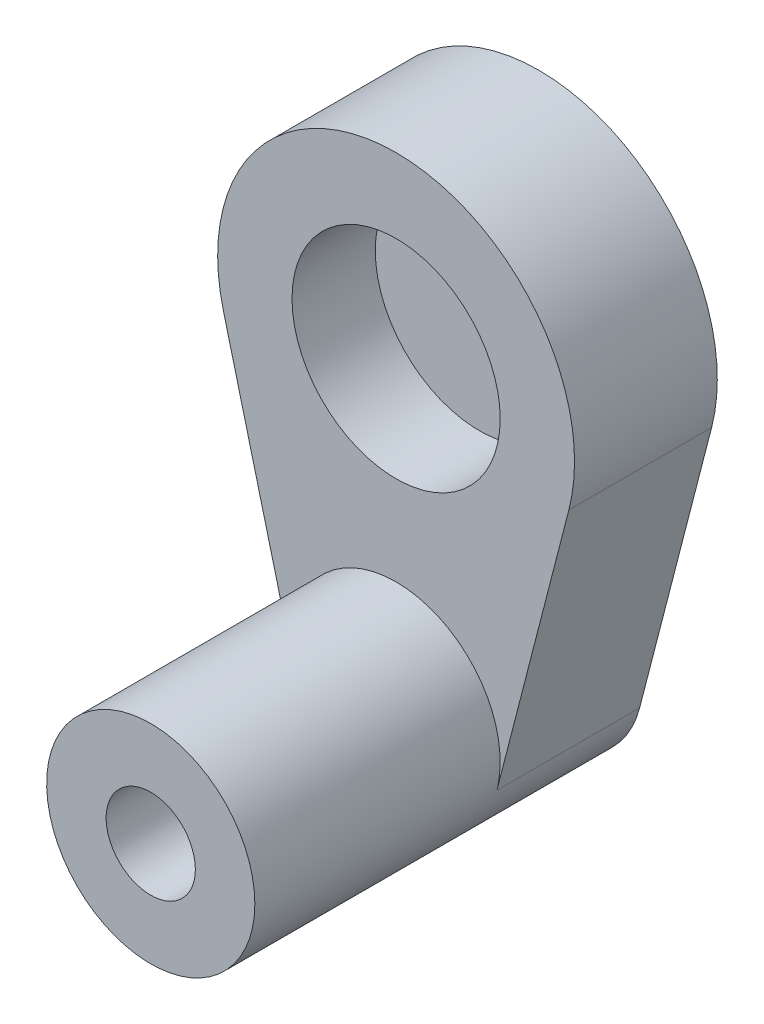
from build123d import *

# Parameters (mm, degrees)
SKETCH1_R           = 3.5
SKETCH1_R_2         = 1.5
BOSS_EXTRUDE1_DEPTH = 8.25
BOSS_EXTRUDE2_START = 2.8
SKETCH2_R           = 6
SKETCH2_R_2         = 3.5
SKETCH2_R_3         = 1.5
BOSS_EXTRUDE2_DEPTH = 2.8
BOSS_EXTRUDE3_START = 4.8
SKETCH2_3_R         = 6
SKETCH2_3_R_2       = 3.5
SKETCH2_3_R_3       = 1.5
BOSS_EXTRUDE3_DEPTH = 2


with BuildPart() as part:
    # Sketch1 → Boss-Extrude1 (new body)
    with BuildSketch(Plane.XY):
        Circle(SKETCH1_R)
        Circle(SKETCH1_R_2, mode=Mode.SUBTRACT)
    extrude(amount=BOSS_EXTRUDE1_DEPTH)

    # Sketch2 → Boss-Extrude2 (add)
    # profile 1 of 4: a face of its own
    with BuildSketch(Plane(origin=(0, 0, 0), x_dir=(-1, 0, 0), z_dir=(0, 0, -1)).offset(BOSS_EXTRUDE2_START)):
        with BuildLine():
            ThreePointArc((5.809475019, 8.5), (0, 4), (-5.809475019, 8.5))
            Line((-5.809475019, 8.5), (-3.388860428, -0.875))
            ThreePointArc((-3.388860428, -0.875), (-0.441015024, 3.472103937), (3.5, 0))
            ThreePointArc((3.5, 0), (3.472103937, -0.441015024), (3.388860428, -0.875))
            Line((3.388860428, -0.875), (5.809475019, 8.5))
        make_face()
    # profile 2 of 4: a face of its own
    with BuildSketch(Plane(origin=(0, 0, 0), x_dir=(-1, 0, 0), z_dir=(0, 0, -1)).offset(BOSS_EXTRUDE2_START)):
        with Locations((0, 10)):
            Circle(SKETCH2_R)
        with Locations((0, 10)):
            Circle(SKETCH2_R_2, mode=Mode.SUBTRACT)
    # profile 3 of 4: a face of its own
    with BuildSketch(Plane(origin=(0, 0, 0), x_dir=(-1, 0, 0), z_dir=(0, 0, -1)).offset(BOSS_EXTRUDE2_START)):
        with Locations(Location((0, 0, 0), (0, 0, 345.522487814))):
            Circle(SKETCH2_R_2)
        with Locations(Location((0, 0, 0), (0, 0, 180))):
            Circle(SKETCH2_R_3, mode=Mode.SUBTRACT)
    # profile 4 of 4: a face of its own
    with BuildSketch(Plane(origin=(0, 0, 0), x_dir=(-1, 0, 0), z_dir=(0, 0, -1)).offset(BOSS_EXTRUDE2_START)):
        with Locations(Location((0, 0, 0), (0, 0, 180))):
            Circle(SKETCH2_R_3)
    extrude(amount=-BOSS_EXTRUDE2_DEPTH)

    # Sketch2<3> → Boss-Extrude3 (add)
    # profile 1 of 5: a face of its own
    with BuildSketch(Plane(origin=(0, 0, 0), x_dir=(-1, 0, 0), z_dir=(0, 0, -1)).offset(BOSS_EXTRUDE3_START)):
        with Locations((0, 10)):
            Circle(SKETCH2_3_R)
        with Locations((0, 10)):
            Circle(SKETCH2_3_R_2, mode=Mode.SUBTRACT)
    # profile 2 of 5: a face of its own
    with BuildSketch(Plane(origin=(0, 0, 0), x_dir=(-1, 0, 0), z_dir=(0, 0, -1)).offset(BOSS_EXTRUDE3_START)):
        with BuildLine():
            ThreePointArc((5.809475019, 8.5), (0, 4), (-5.809475019, 8.5))
            Line((-5.809475019, 8.5), (-3.388860428, -0.875))
            ThreePointArc((-3.388860428, -0.875), (-0.441015024, 3.472103937), (3.5, 0))
            ThreePointArc((3.5, 0), (3.472103937, -0.441015024), (3.388860428, -0.875))
            Line((3.388860428, -0.875), (5.809475019, 8.5))
        make_face()
    # profile 3 of 5: a face of its own
    with BuildSketch(Plane(origin=(0, 0, 0), x_dir=(-1, 0, 0), z_dir=(0, 0, -1)).offset(BOSS_EXTRUDE3_START)):
        with Locations(Location((0, 0, 0), (0, 0, 345.522487814))):
            Circle(SKETCH2_3_R_2)
        with Locations(Location((0, 0, 0), (0, 0, 180))):
            Circle(SKETCH2_3_R_3, mode=Mode.SUBTRACT)
    # profile 4 of 5: a face of its own
    with BuildSketch(Plane(origin=(0, 0, 0), x_dir=(-1, 0, 0), z_dir=(0, 0, -1)).offset(BOSS_EXTRUDE3_START)):
        with Locations((0, 10)):
            Circle(SKETCH2_3_R_2)
    # profile 5 of 5: a face of its own
    with BuildSketch(Plane(origin=(0, 0, 0), x_dir=(-1, 0, 0), z_dir=(0, 0, -1)).offset(BOSS_EXTRUDE3_START)):
        with Locations(Location((0, 0, 0), (0, 0, 180))):
            Circle(SKETCH2_3_R_3)
    extrude(amount=-BOSS_EXTRUDE3_DEPTH)


solid = part.part
